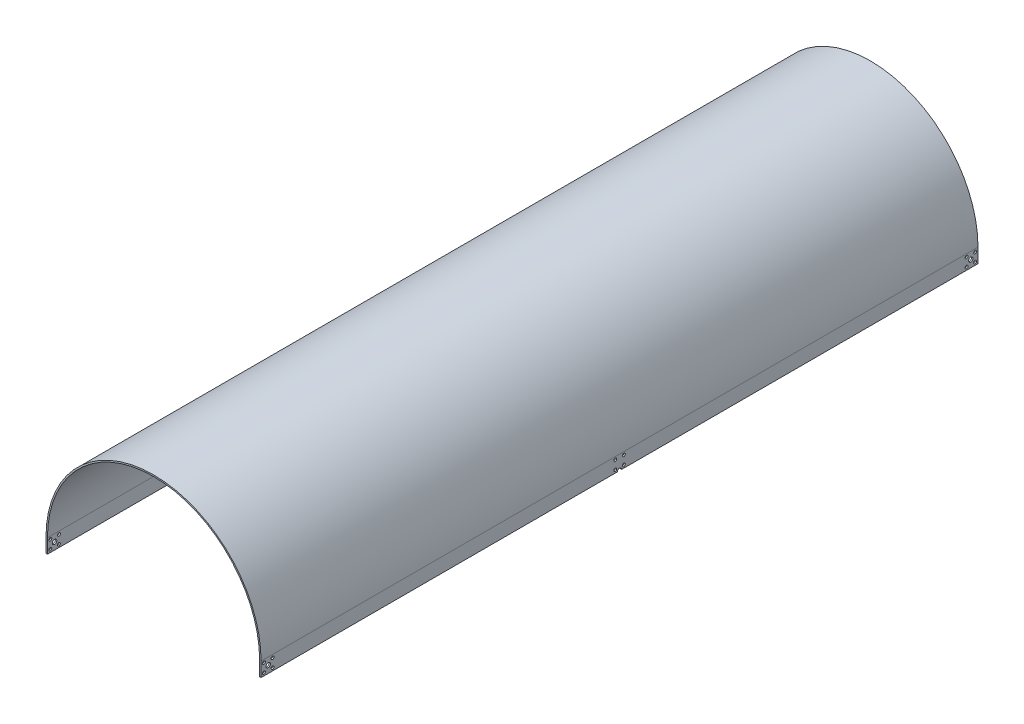
from build123d import *

# Parameters (mm, degrees)
BOSS_EXTRU_1_DEPTH      = 1000
ESQUISSE2_R             = 3.05
ENL_V_MAT_EXTRU_1_DEPTH = 500
ESQUISSE3_R             = 2.05
ENL_V_MAT_EXTRU_2_DEPTH = 5
ESQUISSE4_R             = 3.1
ENL_V_MAT_EXTRU_3_DEPTH = 310


with BuildPart() as part:
    # Esquisse1 → Boss.-Extru.1 (new body)
    with BuildSketch(Plane.XY):
        with BuildLine():
            Line((0, 150), (0, 148))
            ThreePointArc((0, 148), (-104.651803616, 104.651803616), (-148, 0))
            Line((-148, 0), (-148, -20))
            Line((-148, -20), (-150, -20))
            Line((-150, -20), (-150, 0))
            ThreePointArc((-150, 0), (-106.066017178, 106.066017178), (0, 150))
        make_face()
    extrude(amount=BOSS_EXTRU_1_DEPTH)

    # Esquisse2 → Enlèv. mat.-Extru.1 (cut)
    with BuildSketch(Plane.ZY.offset(150)):
        with Locations(Location((10, -10, 0), (0, 0, 270))):
            Circle(ESQUISSE2_R)
        with Locations(Location((990, -10, 0), (0, 0, 270))):
            Circle(ESQUISSE2_R)
    extrude(amount=-ENL_V_MAT_EXTRU_1_DEPTH, mode=Mode.SUBTRACT)

    # Esquisse3 → Enlèv. mat.-Extru.2 (cut)
    with BuildSketch(Plane.ZY.offset(150)):
        with Locations(Location((4, -4, 0), (0, 0, 270))):
            Circle(ESQUISSE3_R)
        with Locations(Location((16, -4, 0), (0, 0, 270))):
            Circle(ESQUISSE3_R)
        with Locations(Location((4, -16, 0), (0, 0, 270))):
            Circle(ESQUISSE3_R)
        with Locations(Location((16, -16, 0), (0, 0, 270))):
            Circle(ESQUISSE3_R)
        with Locations(Location((494, -4, 0), (0, 0, 270))):
            Circle(ESQUISSE3_R)
        with Locations(Location((506, -4, 0), (0, 0, 270))):
            Circle(ESQUISSE3_R)
        with Locations(Location((494, -16, 0), (0, 0, 270))):
            Circle(ESQUISSE3_R)
        with Locations(Location((506, -16, 0), (0, 0, 270))):
            Circle(ESQUISSE3_R)
        with Locations(Location((984, -4, 0), (0, 0, 270))):
            Circle(ESQUISSE3_R)
        with Locations(Location((996, -4, 0), (0, 0, 270))):
            Circle(ESQUISSE3_R)
        with Locations(Location((984, -16, 0), (0, 0, 270))):
            Circle(ESQUISSE3_R)
        with Locations(Location((996, -16, 0), (0, 0, 270))):
            Circle(ESQUISSE3_R)
    extrude(amount=-ENL_V_MAT_EXTRU_2_DEPTH, mode=Mode.SUBTRACT)

    # Symétrie2: part across plane


with BuildPart() as part_1:
    add(part.part)
    add(part.part.mirror(Plane(origin=(0, 150, 1000), x_dir=(0, 0, 1), z_dir=(-1, 0, 0))))

    # Esquisse4 → Enlèv. mat.-Extru.3 (cut)
    with BuildSketch(Plane.ZY.offset(150)):
        with Locations((500, -20)):
            Circle(ESQUISSE4_R)
    extrude(amount=-ENL_V_MAT_EXTRU_3_DEPTH, mode=Mode.SUBTRACT)


solid = part_1.part
